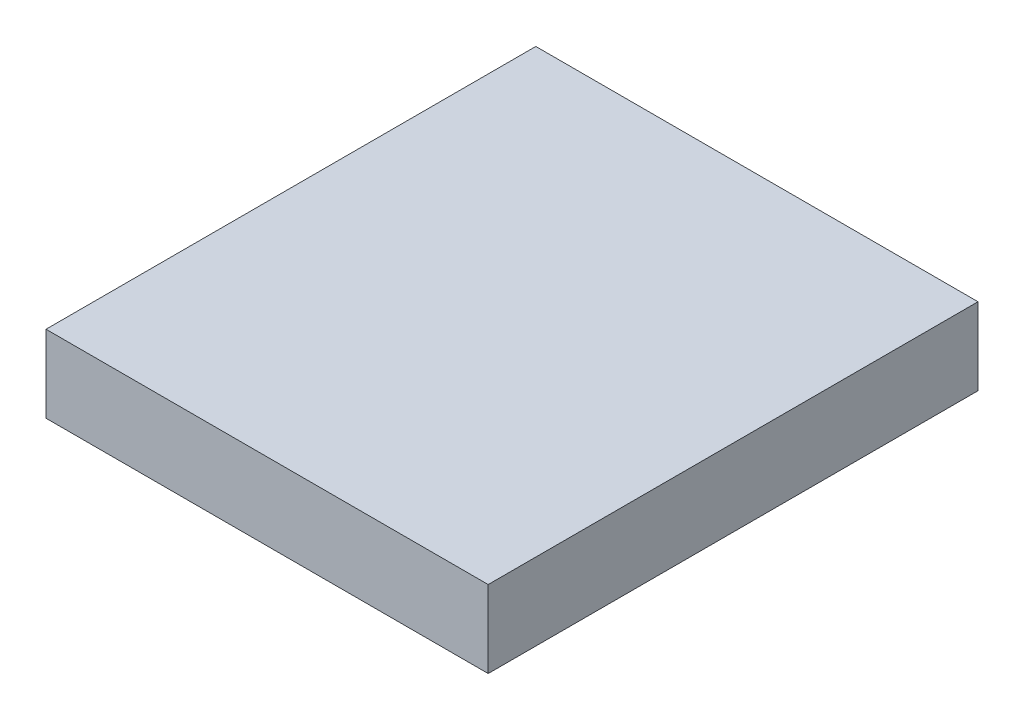
from build123d import *

# Parameters (mm, degrees)
SKETCH1_W           = 49.53
SKETCH1_H           = 54.864
BOSS_EXTRUDE1_DEPTH = 8.636


with BuildPart() as part:
    # Sketch1 → Boss-Extrude1 (new body)
    with BuildSketch(Plane(origin=(0, 0, 0), x_dir=(1, 0, 0), z_dir=(0, 1, 0))):
        with Locations((-0.432786408, -18.103048544)):
            Rectangle(SKETCH1_W, SKETCH1_H)
    extrude(amount=BOSS_EXTRUDE1_DEPTH)


solid = part.part
